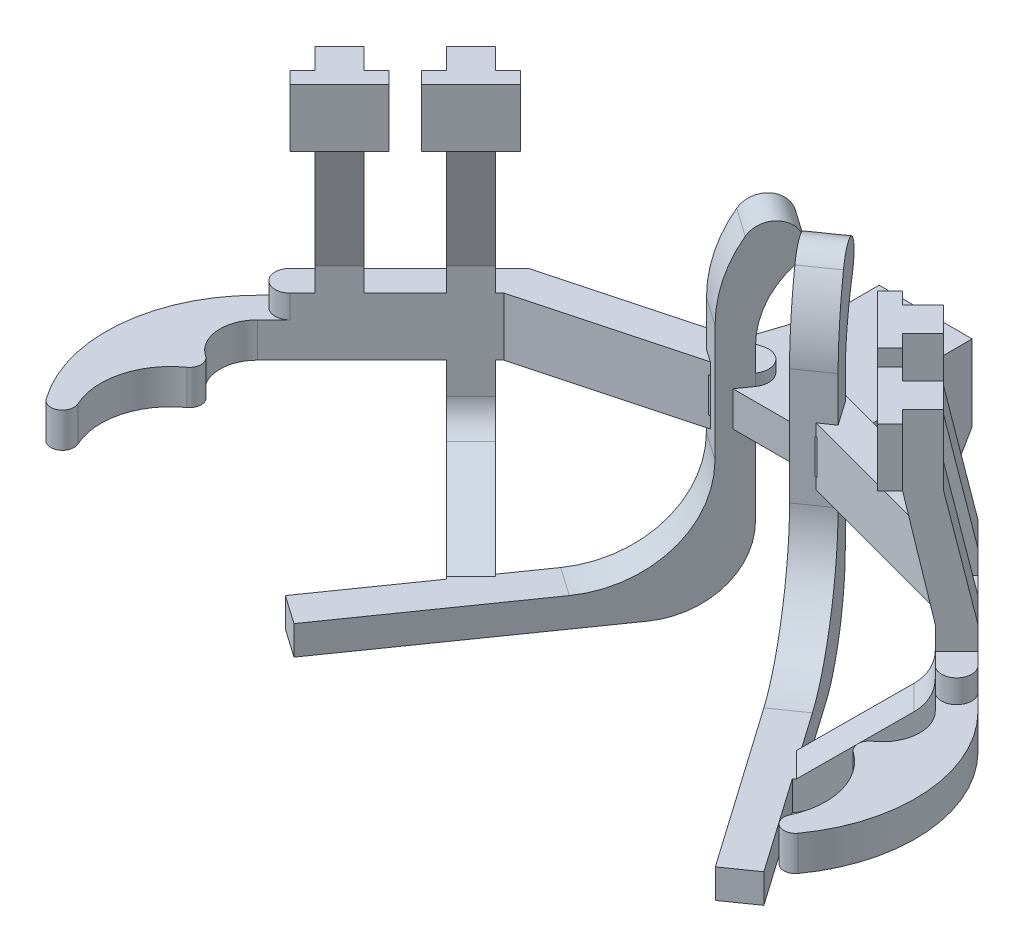
from build123d import *

# Parameters (mm, degrees)
SKETCH2_W                = 80
SKETCH2_H                = 80
BOSS_EXTRUDE1_DEPTH      = 100
SKETCH3_W                = 120
SKETCH3_H                = 100
BOSS_EXTRUDE2_DEPTH      = 30
BOSS_EXTRUDE3_DEPTH      = 10
BOSS_EXTRUDE3_DEPTH_BACK = 40
BOSS_EXTRUDE4_DEPTH      = 15
BOSS_EXTRUDE5_DEPTH      = 15
BOSS_EXTRUDE6_DEPTH      = 15
BOSS_EXTRUDE7_DEPTH      = 50
LPATTERN1_COUNT          = 2
LPATTERN1_PITCH          = 80
BOSS_EXTRUDE8_DEPTH      = 30
SKETCH12_W               = 15
SKETCH12_H               = 25
BOSS_EXTRUDE9_DEPTH      = 10
MIRROR1_COPY_1_DEPTH     = 15
MIRROR1_COPY_2_DEPTH     = 50
CUT_EXTRUDE1_REACH       = 628.398
CUT_EXTRUDE2_REACH       = 563.19


with BuildPart() as part:
    # Sketch2 → Boss-Extrude1 (new body)
    with BuildSketch(Plane(origin=(0, 0, 0), x_dir=(1, 0, 0), z_dir=(0, 1, 0))):
        Rectangle(SKETCH2_W, SKETCH2_H)
    extrude(amount=BOSS_EXTRUDE1_DEPTH)

    # Sketch3 → Boss-Extrude2 (add)
    with BuildSketch(Plane(origin=(0, 100, 0), x_dir=(1, 0, 0), z_dir=(0, 1, 0))):
        with Locations((0, -50)):
            Rectangle(SKETCH3_W, SKETCH3_H)
    extrude(amount=-BOSS_EXTRUDE2_DEPTH)

    # Sketch4 → Boss-Extrude3 (add, two sides: drawn at the far end of the back side and taken through both)
    with BuildSketch(Plane(origin=(0, 100, 0), x_dir=(1, 0, 0), z_dir=(0, 1, 0)).offset(-BOSS_EXTRUDE3_DEPTH_BACK)):
        with BuildLine():
            Line((-33.882285677, -65.511112606), (-193.260047014, -108.216255048))
            Line((-193.260047014, -108.216255048), (-295.790530286, -210.74673832))
            ThreePointArc((-295.790530286, -210.74673832), (-295.790530286, -229.117911391), (-277.419357215, -229.11791139))
            Line((-277.419357215, -229.11791139), (-185.495475661, -137.194029836))
            Line((-185.495475661, -137.194029836), (-26.117714323, -94.488887394))
            ThreePointArc((-26.117714323, -94.488887394), (-15.511112606, -76.117714323), (-33.882285677, -65.511112606))
        make_face()
        with BuildLine():
            Line((185.495475661, -137.194029836), (277.419357215, -229.11791139))
            ThreePointArc((277.419357215, -229.11791139), (295.790530286, -229.117911391), (295.790530286, -210.74673832))
            Line((295.790530286, -210.74673832), (193.260047014, -108.216255048))
            Line((193.260047014, -108.216255048), (33.882285677, -65.511112606))
            ThreePointArc((33.882285677, -65.511112606), (15.511112606, -76.117714323), (26.117714323, -94.488887394))
            Line((26.117714323, -94.488887394), (185.495475661, -137.194029836))
        make_face()
    extrude(amount=BOSS_EXTRUDE3_DEPTH + BOSS_EXTRUDE3_DEPTH_BACK)

    # Sketch5 → Boss-Extrude4 (add, symmetric)
    with BuildSketch(Plane(origin=(17.457402682, 0, 12.223804955), x_dir=(-0.5735764363510497, 0, 0.8191520442889892), z_dir=(-0.8191520442889892, 0, -0.5735764363510497))):
        with BuildLine():
            Line((82.739456634, 130), (82.739456634, 0))
            ThreePointArc((82.739456634, 0), (102.250002331, -47.102624032), (149.352626363, -66.613169729))
            Line((149.352626363, -66.613169729), (367.739456634, -66.613169729))
            Line((367.739456634, -66.613169729), (367.739456634, -41.613169729))
            Line((367.739456634, -41.613169729), (197.739456634, -41.613169729))
            ThreePointArc((197.739456634, -41.613169729), (134.099846327, -15.252780036), (107.739456634, 48.386830271))
            Line((107.739456634, 48.386830271), (107.739456634, 148.386830271))
            ThreePointArc((107.739456634, 148.386830271), (102.976556628, 181.859368041), (89.065943554, 212.674799973))
            ThreePointArc((89.065943554, 212.674799973), (59.535551163, 217.457349016), (58.290447914, 187.568110685))
            ThreePointArc((58.290447914, 187.568110685), (76.373957048, 161.272357583), (82.739456634, 130))
        make_face()
    boss_extrude4 = extrude(amount=BOSS_EXTRUDE4_DEPTH, both=True)

    # Sketch6 → Boss-Extrude5 (add, symmetric)
    with BuildSketch(Plane(origin=(-175.486888372, 0, 175.486888372), x_dir=(-0.7071067811865444, 0, -0.7071067811865508), z_dir=(0.7071067811865508, 0, -0.7071067811865444))):
        with BuildLine():
            Line((34.154279884, 60), (34.154279884, 33.04766127))
            ThreePointArc((34.154279884, 33.04766127), (30.764604879, 19.195202873), (21.361572974, 8.473099941))
            Line((21.361572974, 8.473099941), (-50.16903322, -41.613169729))
            Line((-50.16903322, -41.613169729), (-50.16903322, -66.613169729))
            Line((-50.16903322, -66.613169729), (-35.267080274, -62.895364127))
            Line((-35.267080274, -62.895364127), (36.263525921, -12.809094456))
            ThreePointArc((36.263525921, -12.809094456), (53.809822328, 7.198621996), (60.135041997, 33.04766127))
            Line((60.135041997, 33.04766127), (60.135041997, 60))
            Line((60.135041997, 60), (34.154279884, 60))
        make_face()
    boss_extrude5 = extrude(amount=BOSS_EXTRUDE5_DEPTH, both=True)

    # Sketch7 → Boss-Extrude6 (add, symmetric)
    with BuildSketch(Plane(origin=(-175.486888372, 0, 175.486888372), x_dir=(-0.7071067811865444, 0, -0.7071067811865508), z_dir=(0.7071067811865508, 0, -0.7071067811865444))):
        Polygon((60.135041997, 130), (60.135041997, 110), (34.154279884, 110), (34.154279884, 130), (14.154279884, 230), (14.154279884, 290), (39.154279884, 290), (39.154279884, 230), align=None)
    boss_extrude6 = extrude(amount=BOSS_EXTRUDE6_DEPTH, both=True)

    # Sketch8 → Boss-Extrude7 (add)
    with BuildSketch(Plane(origin=(0, 290, 0), x_dir=(1, 0, 0), z_dir=(0, 1, 0))):
        Polygon((-196.102077379, -197.298106237), (-206.708679097, -186.691504519), (-194.334310426, -174.317135849), (-212.011979956, -156.639466319), (-194.334310426, -138.961796789), (-176.656640896, -156.639466319), (-164.282272226, -144.265097648), (-153.675670508, -154.871699366), align=None)
    boss_extrude7 = extrude(amount=-BOSS_EXTRUDE7_DEPTH)

    # LPattern1: Boss-Extrude6, Boss-Extrude7 ×2
    with Locations(*[Vector(-0.7071067811865528, 0, 0.7071067811865424) * (i * LPATTERN1_PITCH) for i in range(1, LPATTERN1_COUNT)]):
        add(boss_extrude6)
        add(boss_extrude7)

    # Sketch9 → Boss-Extrude8 (add)
    with BuildSketch(Plane.XZ.offset(-60)):
        with BuildLine():
            Line((-295.790530286, 210.74673832), (-277.419357215, 229.11791139))
            Line((-277.419357215, 229.11791139), (-291.561492839, 243.260047014))
            ThreePointArc((-291.561492839, 243.260047014), (-300.787273634, 268.949128658), (-286.837241727, 292.410598278))
            ThreePointArc((-286.837241727, 292.410598278), (-282.432854731, 300.566893993), (-286.620095509, 308.836766982))
            ThreePointArc((-286.620095509, 308.836766982), (-309.763838363, 342.357568274), (-306.167846316, 382.932755195))
            ThreePointArc((-306.167846316, 382.932755195), (-310.178207934, 395.770035716), (-323.340099172, 393.005367469))
            ThreePointArc((-323.340099172, 393.005367469), (-347.597333127, 306.477958579), (-309.93266591, 224.888873943))
            Line((-309.93266591, 224.888873943), (-295.790530286, 210.74673832))
        make_face()
    boss_extrude8 = extrude(amount=-BOSS_EXTRUDE8_DEPTH)

    # Sketch12 → Boss-Extrude9 (add)
    with BuildSketch(Plane(origin=(35.474863596, 0, 35.474863596), x_dir=(0.7071067811865507, 0, -0.7071067811865445), z_dir=(0.7071067811865445, 0, 0.7071067811865507))):
        with Locations((-255.675937555, -54.113169729)):
            Rectangle(SKETCH12_W, SKETCH12_H)
    boss_extrude9 = extrude(amount=BOSS_EXTRUDE9_DEPTH)

    # Mirror1: Boss-Extrude4, Boss-Extrude5, Boss-Extrude6, Boss-Extrude7, Boss-Extrude8, Boss-Extrude9 across plane
    add(boss_extrude4.mirror(Plane(origin=(0, 0, 0), x_dir=(0, 0, 1), z_dir=(1, 0, 0))))
    add(boss_extrude5.mirror(Plane(origin=(0, 0, 0), x_dir=(0, 0, 1), z_dir=(1, 0, 0))))
    add(boss_extrude6.mirror(Plane(origin=(0, 0, 0), x_dir=(0, 0, 1), z_dir=(1, 0, 0))))
    add(boss_extrude7.mirror(Plane(origin=(0, 0, 0), x_dir=(0, 0, 1), z_dir=(1, 0, 0))))
    add(boss_extrude8.mirror(Plane(origin=(0, 0, 0), x_dir=(0, 0, 1), z_dir=(1, 0, 0))))
    add(boss_extrude9.mirror(Plane(origin=(0, 0, 0), x_dir=(0, 0, 1), z_dir=(1, 0, 0))))

    # Mirror1 copy 1 sketch → Mirror1 copy 1 (add, symmetric)
    with BuildSketch(Plane(origin=(232.055430867, 0, 232.055430867), x_dir=(0.7071067811865444, 0, -0.7071067811865508), z_dir=(-0.7071067811865508, 0, -0.7071067811865444))):
        Polygon((60.135041997, -130), (60.135041997, -110), (34.154279884, -110), (34.154279884, -130), (14.154279884, -230), (14.154279884, -290), (39.154279884, -290), (39.154279884, -230), align=None)
    extrude(amount=MIRROR1_COPY_1_DEPTH, both=True)

    # Mirror1 copy 2 sketch → Mirror1 copy 2 (add)
    with BuildSketch(Plane(origin=(56.568542495, 290, 56.568542495), x_dir=(-1, 0, 0), z_dir=(0, 1, 0))):
        Polygon((-196.102077379, 197.298106237), (-206.708679097, 186.691504519), (-194.334310426, 174.317135849), (-212.011979956, 156.639466319), (-194.334310426, 138.961796789), (-176.656640896, 156.639466319), (-164.282272226, 144.265097648), (-153.675670508, 154.871699366), align=None)
    extrude(amount=-MIRROR1_COPY_2_DEPTH)

    # Sketch10 → Cut-Extrude1 (cut, up to next)
    with BuildSketch(Plane(origin=(40, 0, 0), x_dir=(0, 0, -1), z_dir=(1, 0, 0)), mode=Mode.PRIVATE) as cut_extrude1_sk1:
        Polygon((-40, 34.641016151), (-20, 0), (-40, 0), align=None)
    cut_extrude1_tool1 = extrude(cut_extrude1_sk1.sketch, amount=-CUT_EXTRUDE1_REACH, mode=Mode.PRIVATE) & part.part
    # Sketch10 → Cut-Extrude1 (cut, up to next)
    with BuildSketch(Plane(origin=(40, 0, 0), x_dir=(0, 0, -1), z_dir=(1, 0, 0)), mode=Mode.PRIVATE) as cut_extrude1_sk2:
        Polygon((40, 0), (40, 34.641016151), (20, 0), align=None)
    cut_extrude1_tool2 = extrude(cut_extrude1_sk2.sketch, amount=-CUT_EXTRUDE1_REACH, mode=Mode.PRIVATE) & part.part
    add(cut_extrude1_tool1.solids().sort_by_distance((40, 11.547005, 33.333333))[0], mode=Mode.SUBTRACT)
    add(cut_extrude1_tool2.solids().sort_by_distance((40, 11.547005, -33.333333))[0], mode=Mode.SUBTRACT)

    # Sketch11 → Cut-Extrude2 (cut, up to next)
    with BuildSketch(Plane(origin=(0, 100, 0), x_dir=(1, 0, 0), z_dir=(0, 1, 0)), mode=Mode.PRIVATE) as cut_extrude2_sk1:
        Polygon((-40, 0), (-60, -60), (-60, 0), align=None)
    cut_extrude2_tool1 = extrude(cut_extrude2_sk1.sketch, amount=-CUT_EXTRUDE2_REACH, mode=Mode.PRIVATE) & part.part
    # Sketch11 → Cut-Extrude2 (cut, up to next)
    with BuildSketch(Plane(origin=(0, 100, 0), x_dir=(1, 0, 0), z_dir=(0, 1, 0)), mode=Mode.PRIVATE) as cut_extrude2_sk2:
        Polygon((40, 0), (60, -60), (60, 0), align=None)
    cut_extrude2_tool2 = extrude(cut_extrude2_sk2.sketch, amount=-CUT_EXTRUDE2_REACH, mode=Mode.PRIVATE) & part.part
    add(cut_extrude2_tool1.solids().sort_by_distance((-53.333333, 100, 20))[0], mode=Mode.SUBTRACT)
    add(cut_extrude2_tool2.solids().sort_by_distance((53.333333, 100, 20))[0], mode=Mode.SUBTRACT)


solid = part.part
